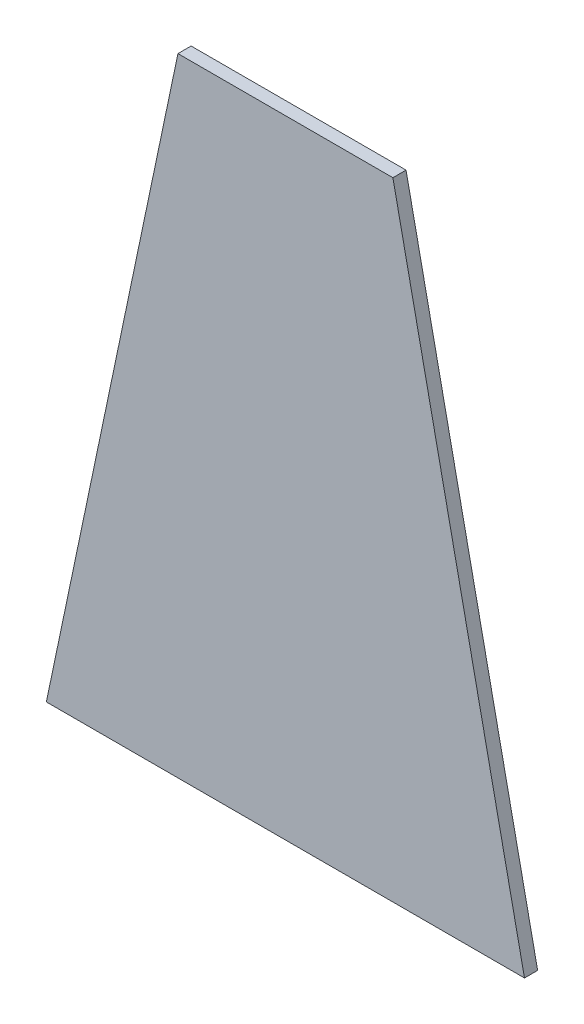
from build123d import *

# Parameters (mm, degrees)
BOSS_EXTRUDE1_DEPTH = 3


with BuildPart() as part:
    # Sketch1 → Boss-Extrude1 (new body)
    with BuildSketch(Plane.XY):
        Polygon((0, 0), (109, 0), (79, 143), (30, 143), align=None)
    extrude(amount=BOSS_EXTRUDE1_DEPTH)


solid = part.part
